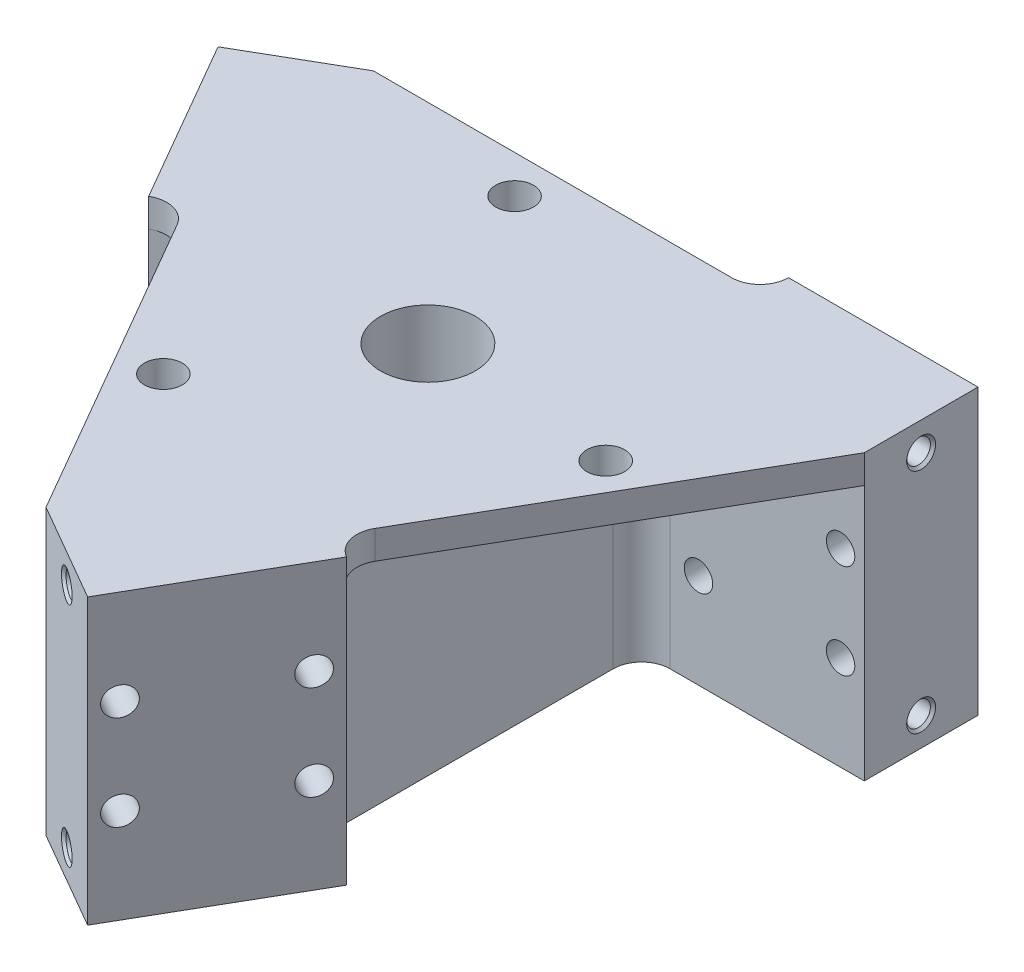
from build123d import *

# Parameters (mm, degrees)
EXTRUDE_1_DEPTH             = 30
FILLET_3_R                  = 3
SKETCH_9_R                  = 5
CUT_EXTRUDE_5_DEPTH         = 64.837130412
CUT_EXTRUDE_6_DEPTH         = 27
PATTERN_CIRCULAR_1_COUNT    = 3
SKETCH_11_W                 = 20
SKETCH_11_H                 = 0.244863729
CUT_EXTRUDE_7_DEPTH         = 64.837130412
CUT_EXTRUDE_8_REACH         = 74.953
SKETCH_12_R                 = 1.5
HOLE_WIZARD_M3_1_AT_2_COUNT = 2
HOLE_WIZARD_M3_1_AT_2_PITCH = 24
PATTERN_CIRCULAR_2_COUNT    = 3
SKETCH_15_R                 = 2
CUT_EXTRUDE_9_DEPTH         = 64.630599801


with BuildPart() as part:
    # 草图1 → 凸台-拉伸1 (new body)
    with BuildSketch(Plane(origin=(0, 0, 0), x_dir=(1, 0, 0), z_dir=(0, 1, 0))):
        Polygon((33, 25.3), (13, 25.3), (13, 22.051270189), (-27.806079661, 22.051270189), (-38.410442716, 15.928838325), (-28.410442716, -1.391669751), (-25.59696017, 0.232695155), (-5.193920339, -35.106406461), (5.410442716, -41.228838325), (15.410442716, -23.908330249), (12.59696017, -22.283965344), (33, 13.055136271), align=None)
    extrude(amount=EXTRUDE_1_DEPTH)

    # 圆角3
    fillet_3_edges = [part.edges().sort_by_distance(p)[0] for p in [
        (13, 15, -22.051270189),
        (12.59696017, 15, 22.283965344),
        (-25.59696017, 15, -0.232695155),
    ]]
    fillet(fillet_3_edges, radius=FILLET_3_R)

    # 草图9 → 切除-拉伸5 (cut, through all)
    with BuildSketch(Plane.XZ):
        with Locations(Location((0, 0, 0), (0, 0, 270))):
            Circle(SKETCH_9_R)
    extrude(amount=-CUT_EXTRUDE_5_DEPTH, mode=Mode.SUBTRACT)

    # 草图10 → 切除-拉伸6 (cut)
    with BuildSketch(Plane.XZ):
        with BuildLine():
            Line((-27.806079661, -22.051270189), (-17.556079661, -4.297749412))
            ThreePointArc((-17.556079661, -4.297749412), (-15.734460585, -2.899971933), (-13.458003449, -3.1996732))
            Line((-13.458003449, -3.1996732), (11.5, -17.60918321))
            ThreePointArc((11.5, -17.60918321), (12.598076211, -18.707259422), (13, -20.207259422))
            Line((13, -20.207259422), (13, -25.051270189))
            Line((13, -25.051270189), (-27.806079661, -22.051270189))
        make_face()
    cut_extrude_6 = extrude(amount=-CUT_EXTRUDE_6_DEPTH, mode=Mode.SUBTRACT)

    # 阵列(圆周)1: 切除-拉伸6 ×3 about axis
    pattern_circular_1_axis = Axis((0, 0, 0), (0, 1, 0))
    for i in range(1, PATTERN_CIRCULAR_1_COUNT):
        add(cut_extrude_6.rotate(pattern_circular_1_axis, i * 360 / PATTERN_CIRCULAR_1_COUNT), mode=Mode.SUBTRACT)

    # 草图11 → 切除-拉伸7 (cut, through all)
    with BuildSketch(Plane.XZ):
        with Locations((23, -25.177568136)):
            Rectangle(SKETCH_11_W, SKETCH_11_H)
    cut_extrude_7 = extrude(amount=-CUT_EXTRUDE_7_DEPTH, mode=Mode.SUBTRACT)

    # 草图12 → 切除-拉伸8 (cut, up to next)
    with BuildSketch(Plane(origin=(0, 0, -13.055136271), x_dir=(-1, 0, 0), z_dir=(0, 0, -1)), mode=Mode.PRIVATE) as cut_extrude_8_sk1:
        with Locations(Location((-30.5, 10, 0), (0, 0, 180))):
            Circle(SKETCH_12_R)
    cut_extrude_8_tool1 = extrude(cut_extrude_8_sk1.sketch, amount=CUT_EXTRUDE_8_REACH, mode=Mode.PRIVATE) & part.part
    # 草图12 → 切除-拉伸8 (cut, up to next)
    with BuildSketch(Plane(origin=(0, 0, -13.055136271), x_dir=(-1, 0, 0), z_dir=(0, 0, -1)), mode=Mode.PRIVATE) as cut_extrude_8_sk2:
        with Locations(Location((-30.5, 20, 0), (0, 0, 180))):
            Circle(SKETCH_12_R)
    cut_extrude_8_tool2 = extrude(cut_extrude_8_sk2.sketch, amount=CUT_EXTRUDE_8_REACH, mode=Mode.PRIVATE) & part.part
    # 草图12 → 切除-拉伸8 (cut, up to next)
    with BuildSketch(Plane(origin=(0, 0, -13.055136271), x_dir=(-1, 0, 0), z_dir=(0, 0, -1)), mode=Mode.PRIVATE) as cut_extrude_8_sk3:
        with Locations(Location((-15.5, 20, 0), (0, 0, 180))):
            Circle(SKETCH_12_R)
    cut_extrude_8_tool3 = extrude(cut_extrude_8_sk3.sketch, amount=CUT_EXTRUDE_8_REACH, mode=Mode.PRIVATE) & part.part
    # 草图12 → 切除-拉伸8 (cut, up to next)
    with BuildSketch(Plane(origin=(0, 0, -13.055136271), x_dir=(-1, 0, 0), z_dir=(0, 0, -1)), mode=Mode.PRIVATE) as cut_extrude_8_sk4:
        with Locations(Location((-15.5, 10, 0), (0, 0, 180))):
            Circle(SKETCH_12_R)
    cut_extrude_8_tool4 = extrude(cut_extrude_8_sk4.sketch, amount=CUT_EXTRUDE_8_REACH, mode=Mode.PRIVATE) & part.part
    cut_extrude_8_1 = cut_extrude_8_tool1.solids().sort_by_distance((30.5, 10, -13.055136))[0]
    add(cut_extrude_8_1, mode=Mode.SUBTRACT)
    cut_extrude_8_2 = cut_extrude_8_tool2.solids().sort_by_distance((30.5, 20, -13.055136))[0]
    add(cut_extrude_8_2, mode=Mode.SUBTRACT)
    cut_extrude_8_3 = cut_extrude_8_tool3.solids().sort_by_distance((15.5, 20, -13.055136))[0]
    add(cut_extrude_8_3, mode=Mode.SUBTRACT)
    cut_extrude_8_4 = cut_extrude_8_tool4.solids().sort_by_distance((15.5, 10, -13.055136))[0]
    add(cut_extrude_8_4, mode=Mode.SUBTRACT)
    cut_extrude_8 = cut_extrude_8_1 + cut_extrude_8_2 + cut_extrude_8_3 + cut_extrude_8_4  # 切除-拉伸8 as one shape, for the pattern or mirror that repeats it

    # 草图14 → M3 螺纹孔1 (revolve, cut)
    with BuildSketch(Plane(origin=(33, 3, -19.055136271), x_dir=(0, 0, -1), z_dir=(0, 1, 0))):
        Polygon((0, 0), (0, 8.251075774), (1.25, 7.5), (1.25, 0.275), (1.525, 0), align=None)
    hole_wizard_m3_1 = revolve(axis=Axis((39.35, 3, -19.055136271), (-1, 0, 0)), mode=Mode.SUBTRACT)

    # M3 螺纹孔1 at 2: M3 螺纹孔1 ×2
    with Locations(*[(0, i * HOLE_WIZARD_M3_1_AT_2_PITCH, 0) for i in range(1, HOLE_WIZARD_M3_1_AT_2_COUNT)]):
        add(hole_wizard_m3_1, mode=Mode.SUBTRACT)

    # 阵列(圆周)2: 切除-拉伸7, 切除-拉伸8, M3 螺纹孔1 ×3 about axis
    pattern_circular_2_axis = Axis((0, 0, 0), (0, 1, 0))
    add([cut_extrude_7.rotate(pattern_circular_2_axis, i * 360 / PATTERN_CIRCULAR_2_COUNT) for i in range(1, PATTERN_CIRCULAR_2_COUNT)], mode=Mode.SUBTRACT)
    add([cut_extrude_8.rotate(pattern_circular_2_axis, i * 360 / PATTERN_CIRCULAR_2_COUNT) for i in range(1, PATTERN_CIRCULAR_2_COUNT)], mode=Mode.SUBTRACT)
    add([hole_wizard_m3_1.rotate(pattern_circular_2_axis, i * 360 / PATTERN_CIRCULAR_2_COUNT) for i in range(1, PATTERN_CIRCULAR_2_COUNT)], mode=Mode.SUBTRACT)

    # 阵列(圆周)2 copy 1 sketch → 阵列(圆周)2 copy 1 (revolve, cut)
    with BuildSketch(Plane(origin=(-33.002232084, 27, -19.051270189), x_dir=(-0.8660254037844396, 0, 0.4999999999999983), z_dir=(0, 1, 0))):
        Polygon((0, 0), (0, 8.251075774), (1.25, 7.5), (1.25, 0.275), (1.525, 0), align=None)
    revolve(axis=Axis((-36.177232084, 27, -24.550531503), (0.4999999999999983, 0, 0.8660254037844396)), mode=Mode.SUBTRACT)

    # 阵列(圆周)2 copy 2 sketch → 阵列(圆周)2 copy 2 (revolve, cut)
    with BuildSketch(Plane(origin=(0.002232084, 27, 38.106406461), x_dir=(0.8660254037844375, 0, 0.5000000000000019), z_dir=(0, 1, 0))):
        Polygon((0, 0), (0, 8.251075774), (1.25, 7.5), (1.25, 0.275), (1.525, 0), align=None)
    revolve(axis=Axis((-3.172767916, 27, 43.605667775), (0.5000000000000019, 0, -0.8660254037844375)), mode=Mode.SUBTRACT)

    # 草图15 → 切除-拉伸9 (cut, through all)
    with BuildSketch(Plane(origin=(0, 30, 0), x_dir=(1, 0, 0), z_dir=(0, 1, 0))):
        with Locations(Location((-8.90303983, 18.051270189, 0), (0, 0, 270))):
            Circle(SKETCH_15_R)
        with Locations(Location((20.08437847, -1.315376431, 0), (0, 0, 270))):
            Circle(SKETCH_15_R)
        with Locations(Location((-11.181338639, -16.735893759, 0), (0, 0, 270))):
            Circle(SKETCH_15_R)
    extrude(amount=-CUT_EXTRUDE_9_DEPTH, mode=Mode.SUBTRACT)


solid = part.part
